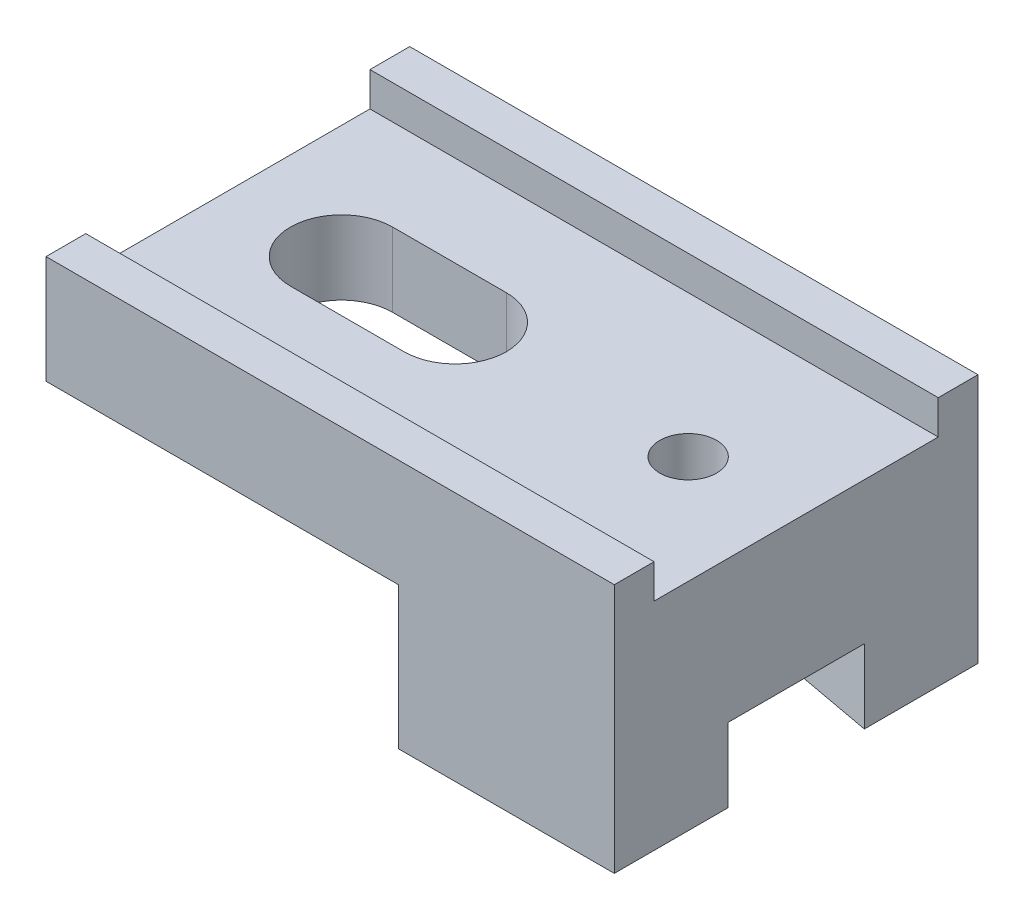
from build123d import *

# Parameters (mm, degrees)
CROQUIS1_W              = 100
CROQUIS1_H              = 64
SALIENTE_EXTRUIR1_DEPTH = 19
CROQUIS2_W              = 50
CROQUIS2_H              = 11.913682473
CORTAR_EXTRUIR1_DEPTH   = 121.237265438
CROQUIS3_W              = 38
CROQUIS3_H              = 64
SALIENTE_EXTRUIR2_DEPTH = 25
CORTAR_EXTRUIR3_DEPTH   = 13
CROQUIS5_R              = 5
CORTAR_EXTRUIR4_DEPTH   = 123.706968017
CROQUIS6_R              = 3
CORTAR_EXTRUIR5_DEPTH   = 20
CORTAR_EXTRUIR6_DEPTH   = 122.330128163


with BuildPart() as part:
    # Croquis1 → Saliente-Extruir1 (new body)
    with BuildSketch(Plane(origin=(0, 0, 0), x_dir=(1, 0, 0), z_dir=(0, 1, 0))):
        with Locations((50, -32)):
            Rectangle(CROQUIS1_W, CROQUIS1_H)
    extrude(amount=SALIENTE_EXTRUIR1_DEPTH)

    # Croquis2 → Cortar-Extruir1 (cut, through all)
    with BuildSketch(Plane.ZY):
        with Locations((32, 18.956841237)):
            Rectangle(CROQUIS2_W, CROQUIS2_H)
    extrude(amount=-CORTAR_EXTRUIR1_DEPTH, mode=Mode.SUBTRACT)

    # Croquis3 → Saliente-Extruir2 (add)
    with BuildSketch(Plane(origin=(0, 0, 0), x_dir=(-1, 0, 0), z_dir=(0, -1, 0))):
        with Locations((-81, -32)):
            Rectangle(CROQUIS3_W, CROQUIS3_H)
    extrude(amount=SALIENTE_EXTRUIR2_DEPTH)

    # Croquis4 → Cortar-Extruir3 (cut)
    with BuildSketch(Plane.XZ.offset(25)):
        Polygon((100, 44), (100, 20), (62, 13), (62, 51), align=None)
    extrude(amount=-CORTAR_EXTRUIR3_DEPTH, mode=Mode.SUBTRACT)

    # Croquis5 → Cortar-Extruir4 (cut, through all)
    with BuildSketch(Plane(origin=(0, -12, 0), x_dir=(-1, 0, 0), z_dir=(0, -1, 0))):
        with Locations(Location((-81, -32, 0), (0, 0, 90))):
            Circle(CROQUIS5_R)
    extrude(amount=-CORTAR_EXTRUIR4_DEPTH, mode=Mode.SUBTRACT)

    # Croquis6 → Cortar-Extruir5 (cut)
    with BuildSketch(Plane(origin=(0, -25, 0), x_dir=(-1, 0, 0), z_dir=(0, -1, 0))):
        with Locations(Location((-87, -10, 0), (0, 0, 90))):
            Circle(CROQUIS6_R)
        with Locations(Location((-87, -54, 0), (0, 0, 90))):
            Circle(CROQUIS6_R)
    extrude(amount=-CORTAR_EXTRUIR5_DEPTH, mode=Mode.SUBTRACT)

    # Croquis7 → Cortar-Extruir6 (cut, through all)
    with BuildSketch(Plane(origin=(0, 0, 0), x_dir=(-1, 0, 0), z_dir=(0, -1, 0))):
        with BuildLine():
            Line((-40, -23), (-20, -23))
            ThreePointArc((-20, -23), (-11, -32), (-20, -41))
            Line((-20, -41), (-40, -41))
            ThreePointArc((-40, -41), (-49, -32), (-40, -23))
        make_face()
    extrude(amount=-CORTAR_EXTRUIR6_DEPTH, mode=Mode.SUBTRACT)


solid = part.part
